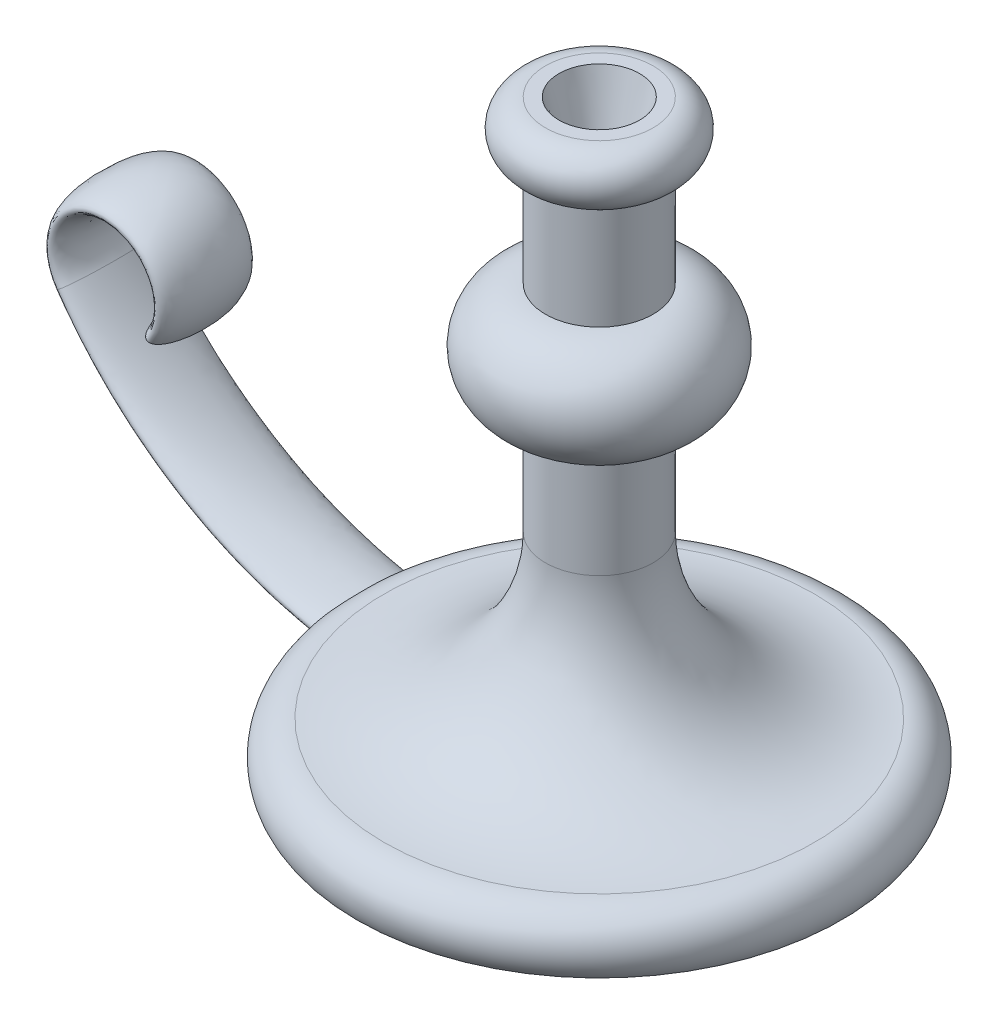
from build123d import *

# Parameters (mm, degrees)
SKETCH4_RX         = 17.5
SKETCH4_RY         = 5
SKETCH5_R          = 15
CUT_EXTRUDE2_DEPTH = 25
CUT_EXTRUDE2_DRAFT = -15


with BuildPart() as part:
    # Sketch1 → Revolve1 (revolve)
    with BuildSketch(Plane.XY, mode=Mode.PRIVATE) as revolve1_sk:
        with BuildLine():
            Line((0, 220), (20, 220))
            ThreePointArc((20, 220), (30, 210), (20, 200))
            Line((20, 200), (20, 160))
            ThreePointArc((20, 160), (40, 140), (20, 120))
            Line((20, 120), (20, 80))
            ThreePointArc((20, 80), (37.573593129, 37.573593129), (80, 20))
            ThreePointArc((80, 20), (91.180339887, 13.090169944), (90, 0))
            Line((90, 0), (0, 0))
            Line((0, 0), (0, 220))
        make_face()
    revolve(revolve1_sk.sketch.rotate(Axis((0, 0, 0), (0, 1, 0)), 90), axis=Axis((0, 0, 0), (0, 1, 0)))

    # Sweep1: sweep along a path in Sketch2
    with BuildLine(Plane.XY) as sweep1_path:
        Line((0, 10), (-60, 10))
        ThreePointArc((-60, 10), (-129.821200219, 27.240819526), (-183.592070943, 75))
        ThreePointArc((-183.592070943, 75), (-167.113128151, 106.333333333), (-150.634185358, 75))
    # Sketch4 → Sweep1 (sweep)
    with BuildSketch(Plane(origin=(0, 0, 0), x_dir=(0, 0, -1), z_dir=(1, 0, 0))):
        with Locations(Location((0, 10), (0, 0, 180))):
            Ellipse(SKETCH4_RX, SKETCH4_RY)
    sweep(path=sweep1_path.line)


with BuildPart() as cut_extrude2_tool:
    # Sketch5 → Cut-Extrude2 (with draft: the straight prism first)
    with BuildSketch(Plane(origin=(0, 220, 0), x_dir=(1, 0, 0), z_dir=(0, 1, 0))):
        Circle(SKETCH5_R)
    extrude(amount=-CUT_EXTRUDE2_DEPTH)
    # Cut-Extrude2: the draft: its side faces are tilted about the plane it starts from
    cut_extrude2_sides = [cut_extrude2_tool.faces().sort_by_distance(p)[0] for p in [
        (-15, 207.5, 0),
    ]]
    draft(cut_extrude2_sides, Plane(origin=(0, 220, 0), x_dir=(1, 0, 0), z_dir=(0, 1, 0)), CUT_EXTRUDE2_DRAFT)


with BuildPart() as part_1:
    add(part.part)

    # Cut-Extrude2: cut by cut_extrude2_tool
    add(cut_extrude2_tool.part, mode=Mode.SUBTRACT)


solid = part_1.part
